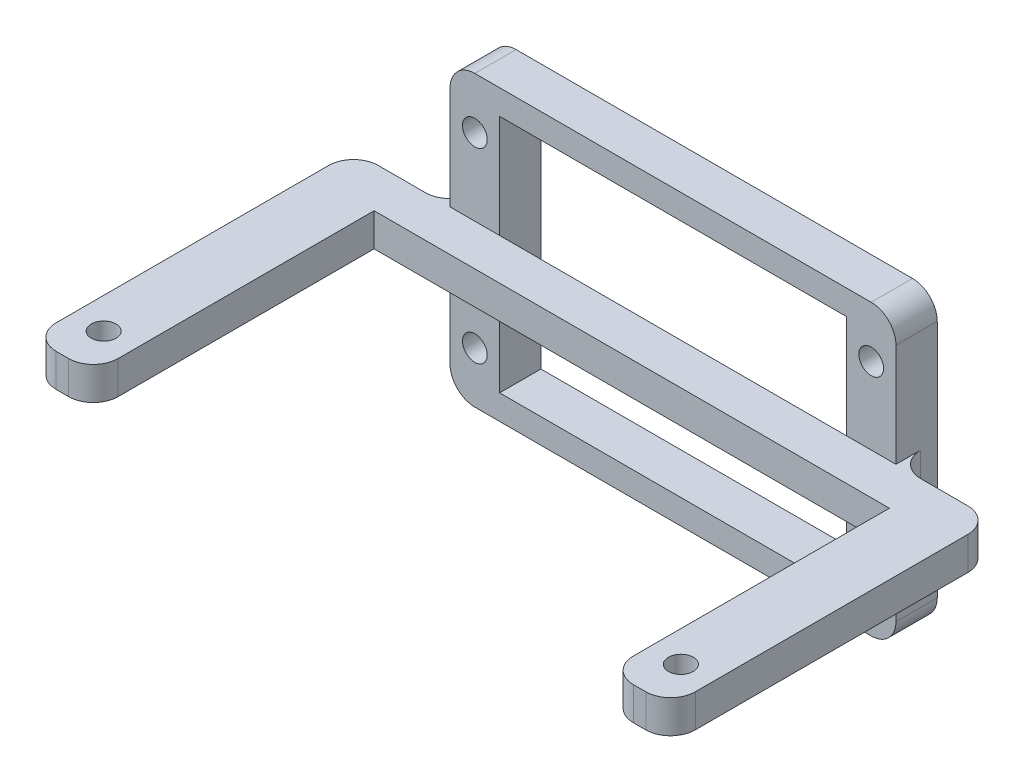
from build123d import *

# Parameters (mm, degrees)
SKETCH_1_R      = 1.5
EXTRUDE_1_DEPTH = 4
SKETCH_3_R      = 1.5
SKETCH_3_W      = 42
SKETCH_3_H      = 29
EXTRUDE_2_DEPTH = 5
FILLET_1_R      = 3
FILLET_2_R      = 3


with BuildPart() as part:
    # 草图1 → 凸台-拉伸1 (new body)
    # profile 1 of 3: a face of its own
    with BuildSketch(Plane(origin=(0, 0, 0), x_dir=(1, 0, 0), z_dir=(0, 1, 0))):
        Polygon((0, 0), (31.2, 0), (31.2, -34), (38.7, -34), (38.7, 5), (0, 5), align=None)
        with Locations(Location((34.95, -29, 0), (0, 0, 270))):
            Circle(SKETCH_1_R, mode=Mode.SUBTRACT)
    # profile 2 of 3: a face of its own
    with BuildSketch(Plane(origin=(0, 0, 0), x_dir=(1, 0, 0), z_dir=(0, 1, 0))):
        with BuildLine():
            Line((-31.2, 0), (0, 0))
            Line((0, 0), (0, 5))
            Line((0, 5), (-34.95, 5))
            Line((-34.95, 5), (-34.95, -27.5))
            ThreePointArc((-34.95, -27.5), (-33.889339828, -27.939339828), (-33.45, -29))
            ThreePointArc((-33.45, -29), (-33.889339828, -30.060660172), (-34.95, -30.5))
            Line((-34.95, -30.5), (-34.95, -34))
            Line((-34.95, -34), (-31.2, -34))
            Line((-31.2, -34), (-31.2, 0))
        make_face()
    # profile 3 of 3: a face of its own
    with BuildSketch(Plane(origin=(0, 0, 0), x_dir=(1, 0, 0), z_dir=(0, 1, 0))):
        with BuildLine():
            Line((-34.95, -27.5), (-34.95, 5))
            Line((-34.95, 5), (-38.7, 5))
            Line((-38.7, 5), (-38.7, -34))
            Line((-38.7, -34), (-34.95, -34))
            Line((-34.95, -34), (-34.95, -30.5))
            ThreePointArc((-34.95, -30.5), (-36.45, -29), (-34.95, -27.5))
        make_face()
    extrude(amount=EXTRUDE_1_DEPTH)

    # 草图3 → 凸台-拉伸2 (add)
    with BuildSketch(Plane(origin=(0, 0, -5), x_dir=(-1, 0, 0), z_dir=(0, 0, -1))):
        Polygon((-27, 2), (-27, -12.5), (-27, -15.5), (27, -15.5), (27, -12.5), (27, 2), (27, 16.5), (27, 19.5), (-27, 19.5), (-27, 16.5), align=None)
        with Locations((-24, 13.3)):
            Circle(SKETCH_3_R, mode=Mode.SUBTRACT)
        with Locations((24, 13.3)):
            Circle(SKETCH_3_R, mode=Mode.SUBTRACT)
        with Locations((24, -9.3)):
            Circle(SKETCH_3_R, mode=Mode.SUBTRACT)
        with Locations((-24, -9.3)):
            Circle(SKETCH_3_R, mode=Mode.SUBTRACT)
        with Locations((0, 2)):
            Rectangle(SKETCH_3_W, SKETCH_3_H, mode=Mode.SUBTRACT)
    extrude(amount=EXTRUDE_2_DEPTH)

    # 圆角1
    fillet_1_edges = [part.edges().sort_by_distance(p)[0] for p in [
        (27, -15.5, -7.5),
        (27, 19.5, -7.5),
        (-27, -15.5, -7.5),
        (-38.7, 2, -5),
        (-27, 19.5, -7.5),
        (-27, 2, -5),
        (38.7, 2, -5),
        (27, 2, -5),
    ]]
    fillet(fillet_1_edges, radius=FILLET_1_R)

    # 圆角2
    fillet_2_edges = [part.edges().sort_by_distance(p)[0] for p in [
        (38.7, 2, 34),
        (31.2, 2, 34),
        (-31.2, 2, 34),
        (-38.7, 2, 34),
    ]]
    fillet(fillet_2_edges, radius=FILLET_2_R)


solid = part.part
